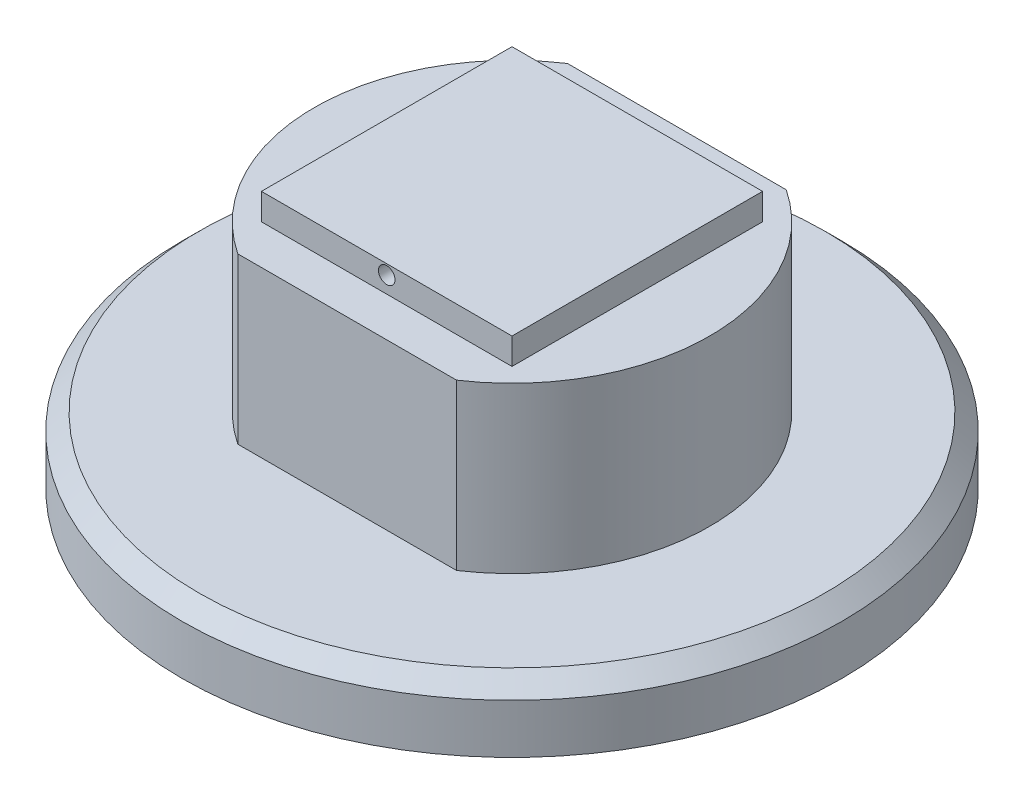
from build123d import *

# Parameters (mm, degrees)
ESTRUSIONE_ESTRUSIONE1_DEPTH = 5
SCHIZZO2_W                   = 7.6
SCHIZZO2_H                   = 7.6
ESTRUSIONE_ESTRUSIONE2_DEPTH = 0.8
SCHIZZO3_R                   = 0.25
TAGLIO_ESTRUSIONE1_DEPTH     = 13.127654349
SCHIZZO4_R                   = 10
ESTRUSIONE_ESTRUSIONE3_DEPTH = 2
SMUSSO1_SIZE                 = 0.5


with BuildPart() as part:
    # Schizzo1 → Estrusione-Estrusione1 (new body)
    with BuildSketch(Plane(origin=(0, 0, 0), x_dir=(1, 0, 0), z_dir=(0, 1, 0))):
        with BuildLine():
            Line((-3.31662479, 5), (3.31662479, 5))
            ThreePointArc((3.31662479, 5), (6, 0), (3.31662479, -5))
            Line((3.31662479, -5), (-3.31662479, -5))
            ThreePointArc((-3.31662479, -5), (-6, 0), (-3.31662479, 5))
        make_face()
    extrude(amount=ESTRUSIONE_ESTRUSIONE1_DEPTH)

    # Schizzo2 → Estrusione-Estrusione2 (add)
    with BuildSketch(Plane(origin=(0, 5, 0), x_dir=(1, 0, 0), z_dir=(0, 1, 0))):
        Rectangle(SCHIZZO2_W, SCHIZZO2_H)
    extrude(amount=ESTRUSIONE_ESTRUSIONE2_DEPTH)

    # Schizzo3 → Taglio-Estrusione1 (cut, through all)
    with BuildSketch(Plane.XY.offset(3.8)):
        with Locations((0, 5.5)):
            Circle(SCHIZZO3_R)
    extrude(amount=-TAGLIO_ESTRUSIONE1_DEPTH, mode=Mode.SUBTRACT)

    # Schizzo4 → Estrusione-Estrusione3 (add)
    with BuildSketch(Plane.XZ):
        with Locations(Location((0, 0, 0), (0, 0, 270))):
            Circle(SCHIZZO4_R)
    extrude(amount=ESTRUSIONE_ESTRUSIONE3_DEPTH)

    # Smusso1
    smusso1_edges = [part.edges().sort_by_distance(p)[0] for p in [
        (0, 0, 10),
    ]]
    chamfer(smusso1_edges, length=SMUSSO1_SIZE)


solid = part.part
